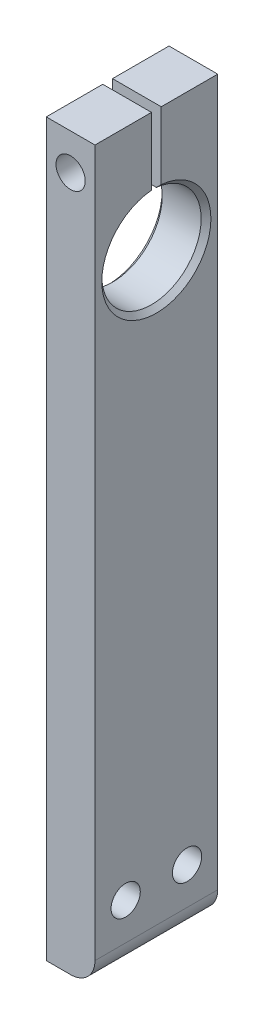
from build123d import *

# Parameters (mm, degrees)
SKETCH1_R           = 10.2
BOSS_EXTRUDE1_DEPTH = 10
SKETCH2_R           = 1.7
CUT_EXTRUDE2_DEPTH  = 127.030789889
SKETCH5_W           = 2
SKETCH5_H           = 25
CUT_EXTRUDE4_DEPTH  = 127.030789889
SKETCH7_R           = 1.7
CUT_EXTRUDE5_DEPTH  = 128.906372007
CUT_EXTRUDE7_DEPTH  = 2.5
FILLET1_R           = 5
CHAMFER1_SIZE       = 1
SKETCH9_R           = 3
CUT_EXTRUDE8_DEPTH  = 8
SKETCH13_R          = 3
CUT_EXTRUDE9_DEPTH  = 5


with BuildPart() as part:
    # Sketch1 → Boss-Extrude1 (new body)
    with BuildSketch(Plane(origin=(0, 0, 0), x_dir=(0, 0, -1), z_dir=(1, 0, 0))):
        Polygon((-12.6, -25), (-12.6, -125), (12.6, -125), (12.6, -25), (12.6, 25), (-12.6, 25), align=None)
        Circle(SKETCH1_R, mode=Mode.SUBTRACT)
    extrude(amount=BOSS_EXTRUDE1_DEPTH)

    # Sketch2 → Cut-Extrude2 (cut, through all)
    with BuildSketch(Plane(origin=(0, 0, 0), x_dir=(0, 0, -1), z_dir=(1, 0, 0))):
        with Locations((-6.3, -112.4)):
            Circle(SKETCH2_R)
        with Locations((6.3, -112.4)):
            Circle(SKETCH2_R)
    extrude(amount=CUT_EXTRUDE2_DEPTH, mode=Mode.SUBTRACT)

    # Sketch5 → Cut-Extrude4 (cut, through all)
    with BuildSketch(Plane.ZY):
        with Locations((0, 12.5)):
            Rectangle(SKETCH5_W, SKETCH5_H)
    extrude(amount=-CUT_EXTRUDE4_DEPTH, mode=Mode.SUBTRACT)

    # Sketch7 → Cut-Extrude5 (cut, through all)
    with BuildSketch(Plane.XY.offset(12.6)):
        with Locations((5, 17.575)):
            Circle(SKETCH7_R)
    extrude(amount=-CUT_EXTRUDE5_DEPTH, mode=Mode.SUBTRACT)

    # Sketch8 → Cut-Extrude7 (cut)
    with BuildSketch(Plane.XY.offset(-4)):
        Polygon((3.267949192, 20.575), (0, 20.575), (0, 14.575), (3.267949192, 14.575), (6.732050808, 14.575), (8.464101615, 17.575), (6.732050808, 20.575), align=None)
    extrude(amount=-CUT_EXTRUDE7_DEPTH, mode=Mode.SUBTRACT)

    # Fillet1
    fillet1_edges = [part.edges().sort_by_distance(p)[0] for p in [
        (10, -125, 0),
    ]]
    fillet(fillet1_edges, radius=FILLET1_R)

    # Chamfer1
    chamfer1_edges = [part.edges().sort_by_distance(p)[0] for p in [
        (10, -10.2, 0),
        (0, -10.2, 0),
    ]]
    chamfer(chamfer1_edges, length=CHAMFER1_SIZE)

    # Sketch9 → Cut-Extrude8 (cut)
    with BuildSketch(Plane.XY.offset(12.6)):
        with Locations((5, 17.575)):
            Circle(SKETCH9_R)
    extrude(amount=-CUT_EXTRUDE8_DEPTH, mode=Mode.SUBTRACT)

    # Sketch13 → Cut-Extrude9 (cut)
    with BuildSketch(Plane(origin=(10, 0, 0), x_dir=(0, 0, -1), z_dir=(1, 0, 0))):
        with Locations((6.3, -112.4)):
            Circle(SKETCH13_R)
        with Locations((-6.3, -112.4)):
            Circle(SKETCH13_R)
    extrude(amount=-CUT_EXTRUDE9_DEPTH, mode=Mode.SUBTRACT)


solid = part.part
